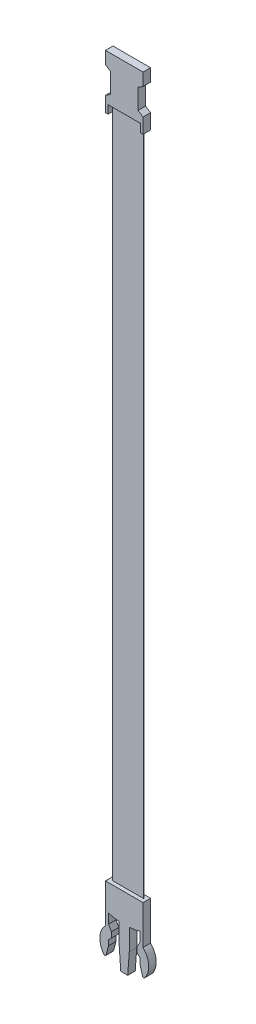
from build123d import *

# Parameters (mm, degrees)
ESQUISSE1_W           = 25
ESQUISSE1_H           = 550
EXTRUSION1_DEPTH      = 0.2
EXTRUSION2_DEPTH      = 3
EXTRUSION2_DEPTH_BACK = 3
EXTRUSION3_DEPTH      = 3
EXTRUSION3_DEPTH_BACK = 3


with BuildPart() as part:
    # Esquisse1 → Extrusion1 (new body)
    with BuildSketch(Plane.XY):
        with Locations((12.5, 275)):
            Rectangle(ESQUISSE1_W, ESQUISSE1_H)
    extrude(amount=EXTRUSION1_DEPTH)

    # Esquisse3 → Extrusion3 (add, two sides: drawn at the far end of the back side and taken through both)
    with BuildSketch(Plane.XY.offset(0.2).offset(-EXTRUSION3_DEPTH_BACK)):
        with BuildLine():
            Line((-2.5, 15), (-2.5, -16.050493534))
            ThreePointArc((-2.5, -16.050493534), (-6.978018175, -25.972905965), (-3.771522068, -36.376044816))
            ThreePointArc((-3.771522068, -36.376044816), (-2.784540643, -36.74292693), (-2.016270834, -36.022860045))
            Line((-2.016270834, -36.022860045), (0, -28.543432251))
            Line((0, -28.543432251), (0, -24.40673249))
            Line((0, -24.40673249), (2.231996633, -22.174735857))
            Line((2.231996633, -22.174735857), (2.231996633, -17.848828872))
            Line((2.231996633, -17.848828872), (0, -13.643085971))
            Line((0, -13.643085971), (0, -5.949496262))
            ThreePointArc((0, -5.949496262), (4.195848556, -7.019821856), (8.5, -7.494187032))
            Line((8.5, -7.494187032), (8.5, -24.453508065))
            Line((8.5, -24.453508065), (9.730786536, -41.412829098))
            Line((9.730786536, -41.412829098), (15.269213464, -41.412829098))
            Line((15.269213464, -41.412829098), (16.5, -24.453508065))
            Line((16.5, -24.453508065), (16.5, -7.494187032))
            ThreePointArc((16.5, -7.494187032), (20.804151444, -7.019821856), (25, -5.949496262))
            Line((25, -5.949496262), (25, -13.643085971))
            Line((25, -13.643085971), (22.768003367, -17.848828872))
            Line((22.768003367, -17.848828872), (22.768003367, -22.174735857))
            Line((22.768003367, -22.174735857), (25, -24.40673249))
            Line((25, -24.40673249), (25, -28.543432251))
            Line((25, -28.543432251), (27.016270834, -36.022860045))
            ThreePointArc((27.016270834, -36.022860045), (27.784540643, -36.74292693), (28.771522068, -36.376044816))
            ThreePointArc((28.771522068, -36.376044816), (31.978018175, -25.972905965), (27.5, -16.050493534))
            Line((27.5, -16.050493534), (27.5, 15))
            Line((27.5, 15), (-2.5, 15))
        make_face()
    extrude(amount=EXTRUSION3_DEPTH + EXTRUSION3_DEPTH_BACK)


with BuildPart() as body_2:
    # Esquisse2 → Extrusion2 (new, two sides: drawn at the far end of the back side and taken through both)
    with BuildSketch(Plane.XY.offset(0.2).offset(-EXTRUSION2_DEPTH_BACK)):
        Polygon((-2.5, 545.875442138), (-2.5, 557.875442138), (1.5, 560.404747727), (1.5, 576.404747727), (-2.5, 578.934053316), (-2.5, 588.934053316), (27.5, 588.934053316), (27.5, 578.934053316), (23.5, 576.404747727), (23.5, 560.404747727), (27.5, 557.875442138), (27.5, 545.875442138), (25.400146352, 545.875442138), (25.400146352, 552.456132333), (-0.400146352, 552.456132333), (-0.400146352, 545.875442138), align=None)
    extrude(amount=EXTRUSION2_DEPTH + EXTRUSION2_DEPTH_BACK)


solid = Compound([part.part, body_2.part])
